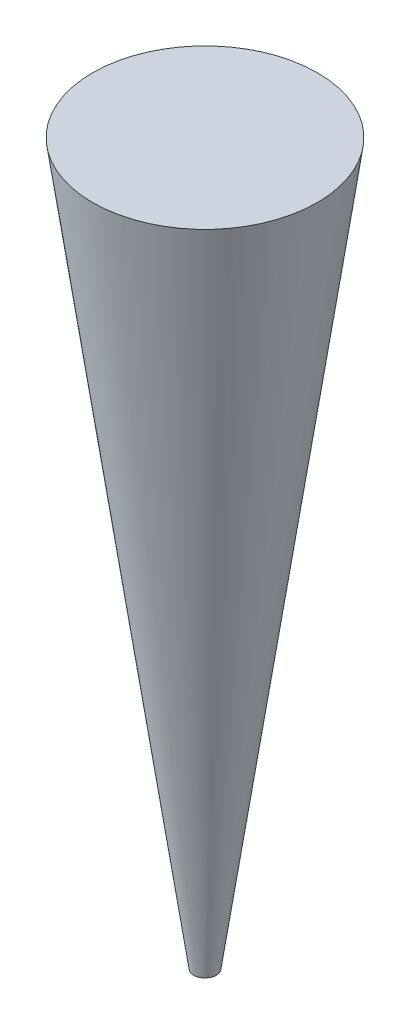
from build123d import *

# Parameters (mm, degrees)
CUT_EXTRUDE1_DEPTH      = 306.868126354
CUT_EXTRUDE1_DEPTH_BACK = 306.868126354
SKETCH2_W               = 18.117925639
SKETCH2_H               = 30


with BuildPart() as part:
    # Sketch1 → Revolve1 (revolve)
    with BuildSketch(Plane.XY, mode=Mode.PRIVATE) as revolve1_sk:
        Polygon((0, 0), (0, 300), (42.162250411, 300), align=None)
    revolve(revolve1_sk.sketch.rotate(Axis((0, 0, 0), (0, 1, 0)), 270), axis=Axis((0, 0, 0), (0, 1, 0)))

    # Sketch2 → Cut-Extrude1 (cut, two sides: drawn at the far end of the back side and taken through both)
    with BuildSketch(Plane.XY.offset(-CUT_EXTRUDE1_DEPTH_BACK)):
        with Locations((-1.090869868, 15)):
            Rectangle(SKETCH2_W, SKETCH2_H)
    extrude(amount=CUT_EXTRUDE1_DEPTH + CUT_EXTRUDE1_DEPTH_BACK, mode=Mode.SUBTRACT)


solid = part.part
